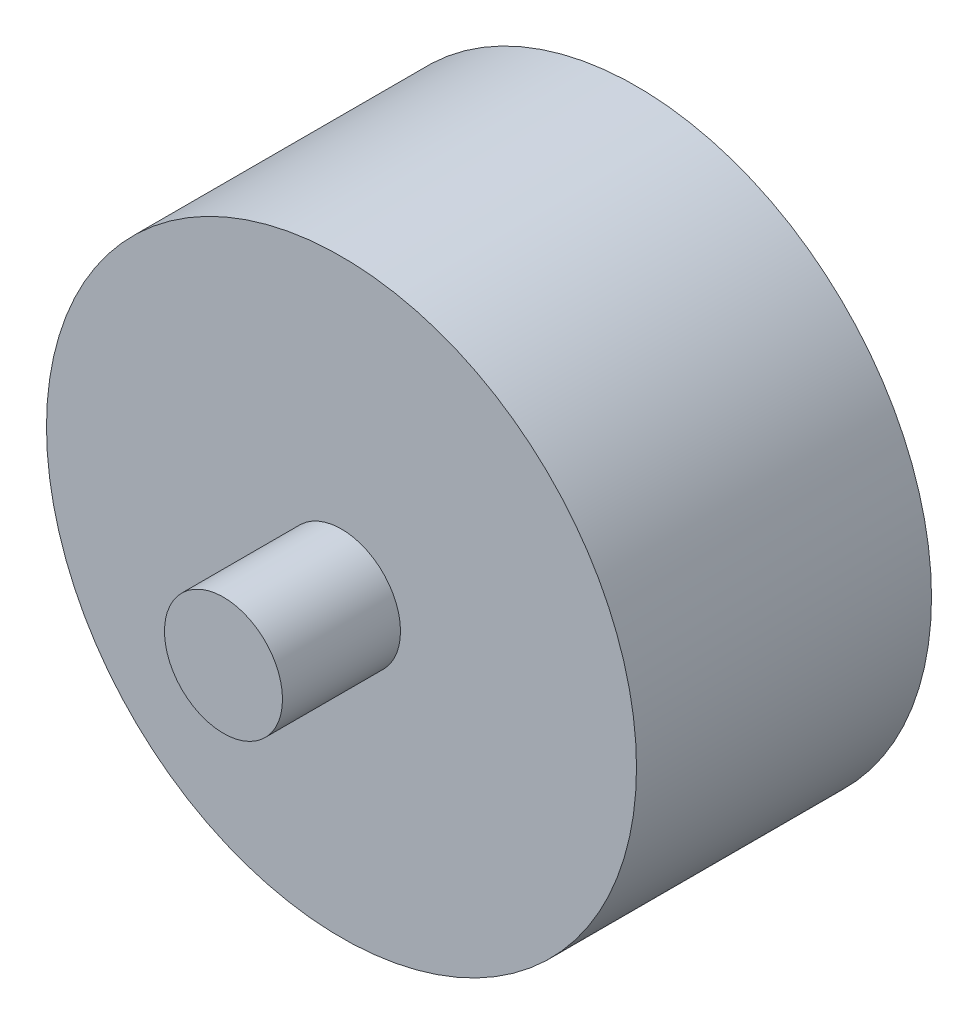
from build123d import *

# Parameters (mm, degrees)
SKETCH1_R           = 50
BOSS_EXTRUDE1_DEPTH = 25
SKETCH2_R           = 10
BOSS_EXTRUDE2_DEPTH = 20
BOSS_EXTRUDE3_START = 20
SKETCH3_R           = 10
BOSS_EXTRUDE3_DEPTH = 20


with BuildPart() as part:
    # Sketch1 → Boss-Extrude1 (new, symmetric)
    with BuildSketch(Plane.XY):
        Circle(SKETCH1_R)
    extrude(amount=BOSS_EXTRUDE1_DEPTH, both=True)

    # Sketch2 → Boss-Extrude2 (add)
    with BuildSketch(Plane(origin=(0, 0, -25), x_dir=(-1, 0, 0), z_dir=(0, 0, -1))):
        Circle(SKETCH2_R)
    extrude(amount=BOSS_EXTRUDE2_DEPTH)

    # Sketch3 → Boss-Extrude3 (add)
    with BuildSketch(Plane.XY.offset(25).offset(BOSS_EXTRUDE3_START)):
        with Locations(Location((0, 0, 0), (0, 0, 180))):
            Circle(SKETCH3_R)
    extrude(amount=-BOSS_EXTRUDE3_DEPTH)


solid = part.part
